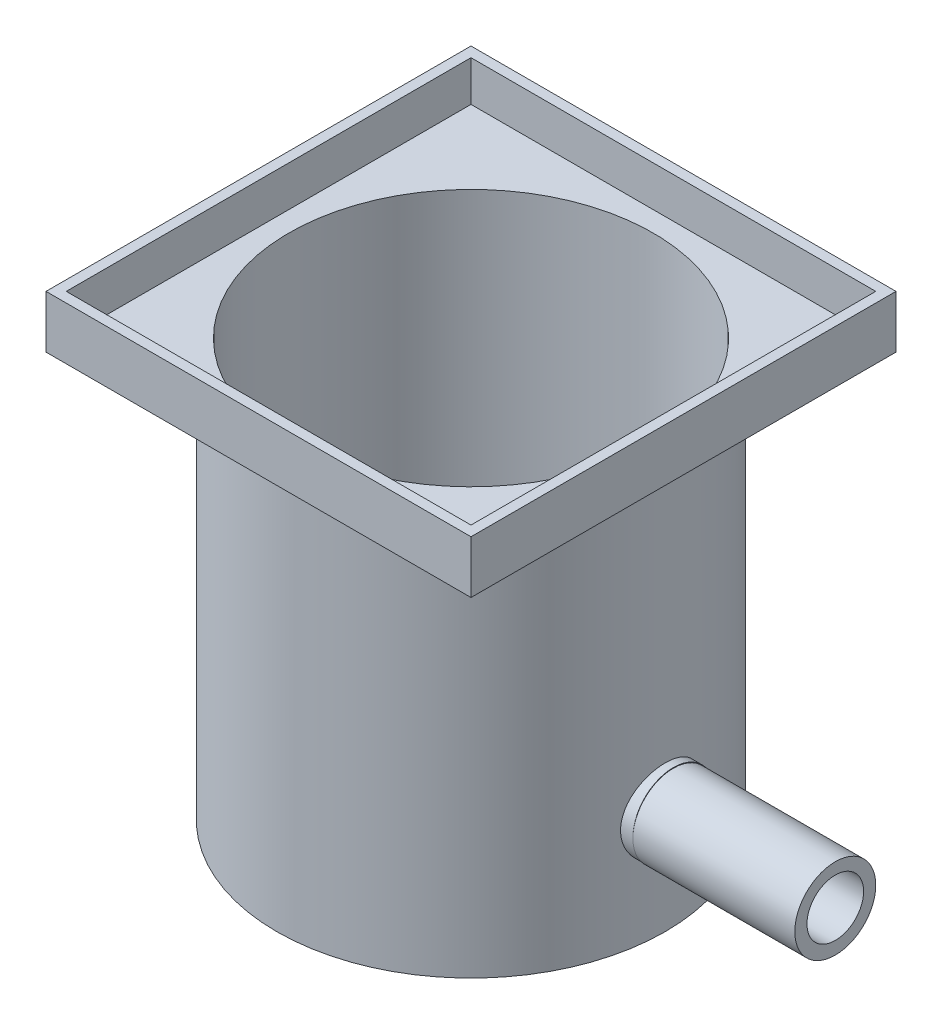
from build123d import *

# Parameters (mm, degrees)
SKETCH3_R                = 48
SKETCH3_R_2              = 45
BOSS_EXTRUDE1_DEPTH      = 100
BOSS_EXTRUDE2_REACH      = 150.014
BOSS_EXTRUDE2_END_RADIUS = 48
SKETCH5_R                = 10
SKETCH6_R                = 10
BOSS_EXTRUDE3_DEPTH      = 40
SKETCH7_R                = 7
CUT_EXTRUDE1_DEPTH       = 55
SKETCH8_W                = 105
SKETCH8_H                = 105
SKETCH8_R                = 45
BOSS_EXTRUDE4_DEPTH      = 3
SKETCH9_W                = 105
SKETCH9_H                = 105
SKETCH9_W_2              = 100
SKETCH9_H_2              = 100
BOSS_EXTRUDE5_DEPTH      = 10


with BuildPart() as part:
    # Sketch3 → Boss-Extrude1 (new body)
    with BuildSketch(Plane(origin=(0, 0, 0), x_dir=(1, 0, 0), z_dir=(0, 1, 0))):
        with Locations(Location((0, 0, 0), (0, 0, 270))):
            Circle(SKETCH3_R)
        with Locations(Location((0, 0, 0), (0, 0, 270))):
            Circle(SKETCH3_R_2, mode=Mode.SUBTRACT)
    extrude(amount=BOSS_EXTRUDE1_DEPTH)

    # Boss-Extrude2: up to this cylinder (the profile starts outside it)
    boss_extrude2_end = Plane(origin=(0, 26.126098, 0), z_dir=(0, -1, 0)) * Cylinder(BOSS_EXTRUDE2_END_RADIUS, 397.028, mode=Mode.PRIVATE)
    # Sketch5 → Boss-Extrude2 (add, up to the surface)
    with BuildSketch(Plane(origin=(50, 0, 0), x_dir=(0, 0, -1), z_dir=(1, 0, 0)), mode=Mode.PRIVATE) as boss_extrude2_sk1:
        with Locations((0, 26.126097613)):
            Circle(SKETCH5_R)
    boss_extrude2_tool1 = extrude(boss_extrude2_sk1.sketch, amount=-BOSS_EXTRUDE2_REACH, mode=Mode.PRIVATE) - boss_extrude2_end
    add(boss_extrude2_tool1.solids().sort_by_distance((50, 26.126098, 0))[0])

    # Sketch6 → Boss-Extrude3 (add)
    with BuildSketch(Plane(origin=(50, 0, 0), x_dir=(0, 0, -1), z_dir=(1, 0, 0))):
        with Locations(Location((0, 25.974996965, 0), (0, 0, 179.567124411))):
            Circle(SKETCH6_R)
    extrude(amount=BOSS_EXTRUDE3_DEPTH)

    # Sketch7 → Cut-Extrude1 (cut)
    with BuildSketch(Plane(origin=(90, 0, 0), x_dir=(0, 0, -1), z_dir=(1, 0, 0))):
        with Locations((0, 26.126097613)):
            Circle(SKETCH7_R)
    extrude(amount=-CUT_EXTRUDE1_DEPTH, mode=Mode.SUBTRACT)

    # Sketch8 → Boss-Extrude4 (add)
    with BuildSketch(Plane(origin=(0, 100, 0), x_dir=(1, 0, 0), z_dir=(0, 1, 0))):
        Rectangle(SKETCH8_W, SKETCH8_H)
        with Locations(Location((0, 0, 0), (0, 0, 270))):
            Circle(SKETCH8_R, mode=Mode.SUBTRACT)
    extrude(amount=BOSS_EXTRUDE4_DEPTH)

    # Sketch9 → Boss-Extrude5 (add)
    with BuildSketch(Plane(origin=(0, 103, 0), x_dir=(1, 0, 0), z_dir=(0, 1, 0))):
        Rectangle(SKETCH9_W, SKETCH9_H)
        Rectangle(SKETCH9_W_2, SKETCH9_H_2, mode=Mode.SUBTRACT)
    extrude(amount=BOSS_EXTRUDE5_DEPTH)


solid = part.part
